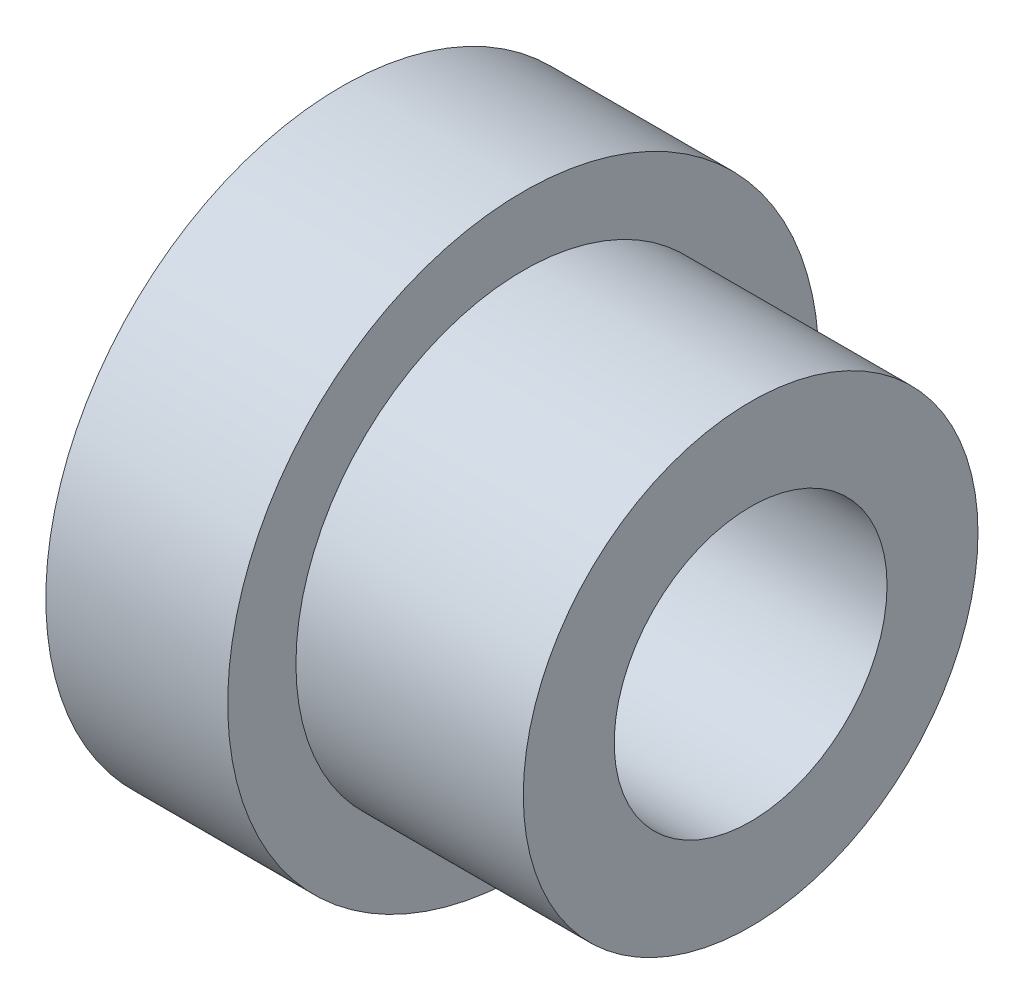
from build123d import *

# Parameters (mm, degrees)
SKETCH1_R           = 15.875
SKETCH1_R_2         = 9.525
BOSS_EXTRUDE1_DEPTH = 28.575
SKETCH1_3_R         = 20.6375
SKETCH1_3_R_2       = 15.875
BOSS_EXTRUDE2_DEPTH = 12.7


with BuildPart() as part:
    # Sketch1 → Boss-Extrude1 (new body)
    with BuildSketch(Plane(origin=(0, 0, 0), x_dir=(0, 0, -1), z_dir=(1, 0, 0))):
        Circle(SKETCH1_R)
        Circle(SKETCH1_R_2, mode=Mode.SUBTRACT)
    extrude(amount=BOSS_EXTRUDE1_DEPTH)

    # Sketch1<3> → Boss-Extrude2 (add)
    with BuildSketch(Plane(origin=(0, 0, 0), x_dir=(0, 0, -1), z_dir=(1, 0, 0))):
        Circle(SKETCH1_3_R)
        Circle(SKETCH1_3_R_2, mode=Mode.SUBTRACT)
    extrude(amount=BOSS_EXTRUDE2_DEPTH)


solid = part.part
